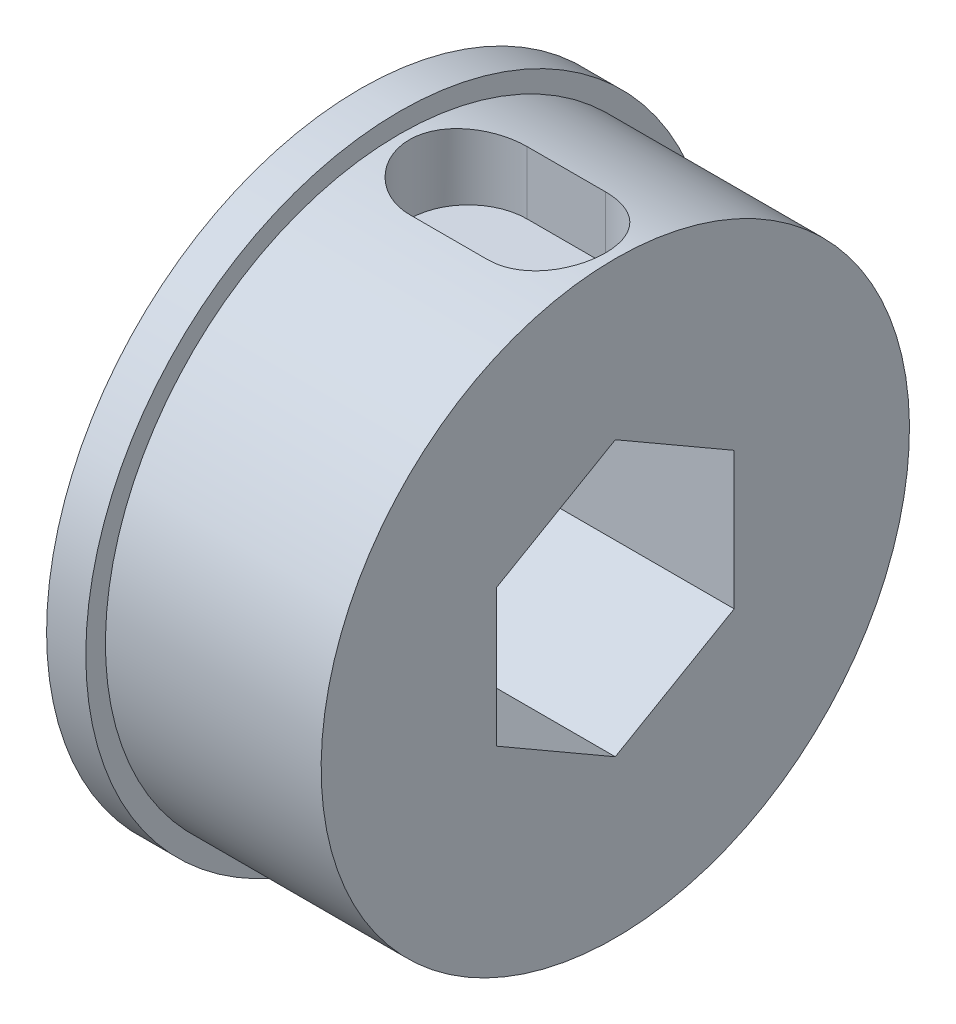
from build123d import *

# Parameters (mm, degrees)
CUT_EXTRUDE1_DEPTH = 27.095976701
CUT_EXTRUDE2_DEPTH = 3.5


with BuildPart() as part:
    # Sketch1 → Revolve1 (revolve)
    with BuildSketch(Plane.XY):
        Polygon((0, 0), (0, 16), (2, 16), (2, 15), (13, 15), (13, 0), align=None)
    revolve(axis=Axis((13, 0, 0), (-1, 0, 0)))

    # Sketch2 → Cut-Extrude1 (cut, through all)
    with BuildSketch(Plane(origin=(13, 0, 0), x_dir=(0, 0, -1), z_dir=(1, 0, 0))):
        Polygon((0, 7), (-6.062177826, 3.5), (-6.062177826, -3.5), (0, -7), (6.062177826, -3.5), (6.062177826, 3.5), align=None)
    extrude(amount=-CUT_EXTRUDE1_DEPTH, mode=Mode.SUBTRACT)

    # Sketch3 → Cut-Extrude2 (cut)
    with BuildSketch(Plane(origin=(0, 15, 0), x_dir=(1, 0, 0), z_dir=(0, 1, 0))):
        with BuildLine():
            Line((5.5, 3), (9.5, 3))
            ThreePointArc((9.5, 3), (12.5, 0), (9.5, -3))
            Line((9.5, -3), (5.5, -3))
            ThreePointArc((5.5, -3), (2.5, 0), (5.5, 3))
        make_face()
    extrude(amount=-CUT_EXTRUDE2_DEPTH, mode=Mode.SUBTRACT)


solid = part.part
